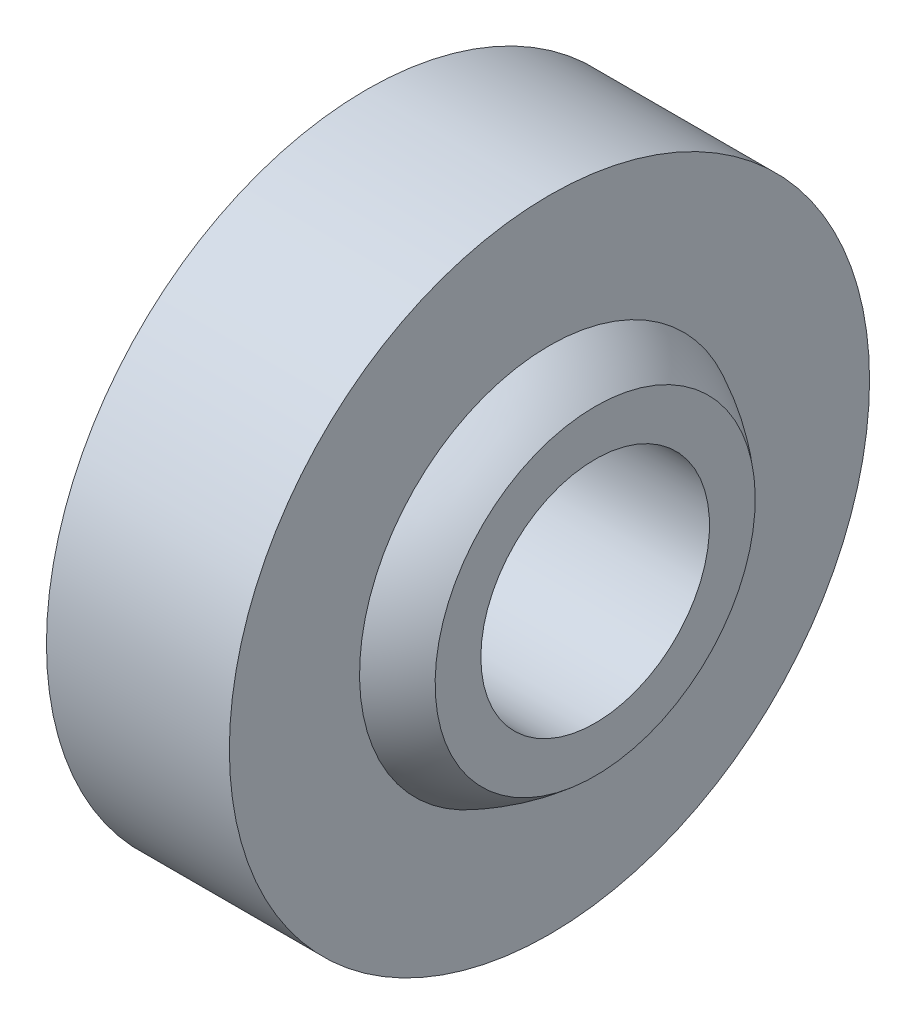
from build123d import *

# Parameters (mm, degrees)
SKETCH_3_W = 4
SKETCH_3_H = 2.846688069


with BuildPart() as part:
    # 草图1 → 旋转1 (revolve)
    with BuildSketch(Plane.XY):
        with BuildLine():
            Line((-3, 2.5), (3, 2.5))
            Line((3, 2.5), (3, 3.5))
            ThreePointArc((3, 3.5), (0, 4.609772229), (-3, 3.5))
            Line((-3, 3.5), (-3, 2.5))
        make_face()
    revolve(axis=Axis((-2.955836333, 0, 0), (1, 0, 0)))

    # 草图3 → 旋转2 (revolve)
    with BuildSketch(Plane.XY):
        with Locations((0, 5.576655966)):
            Rectangle(SKETCH_3_W, SKETCH_3_H)
    revolve(axis=Axis((-4.355808745, 0, 0), (1, 0, 0)))


solid = part.part
